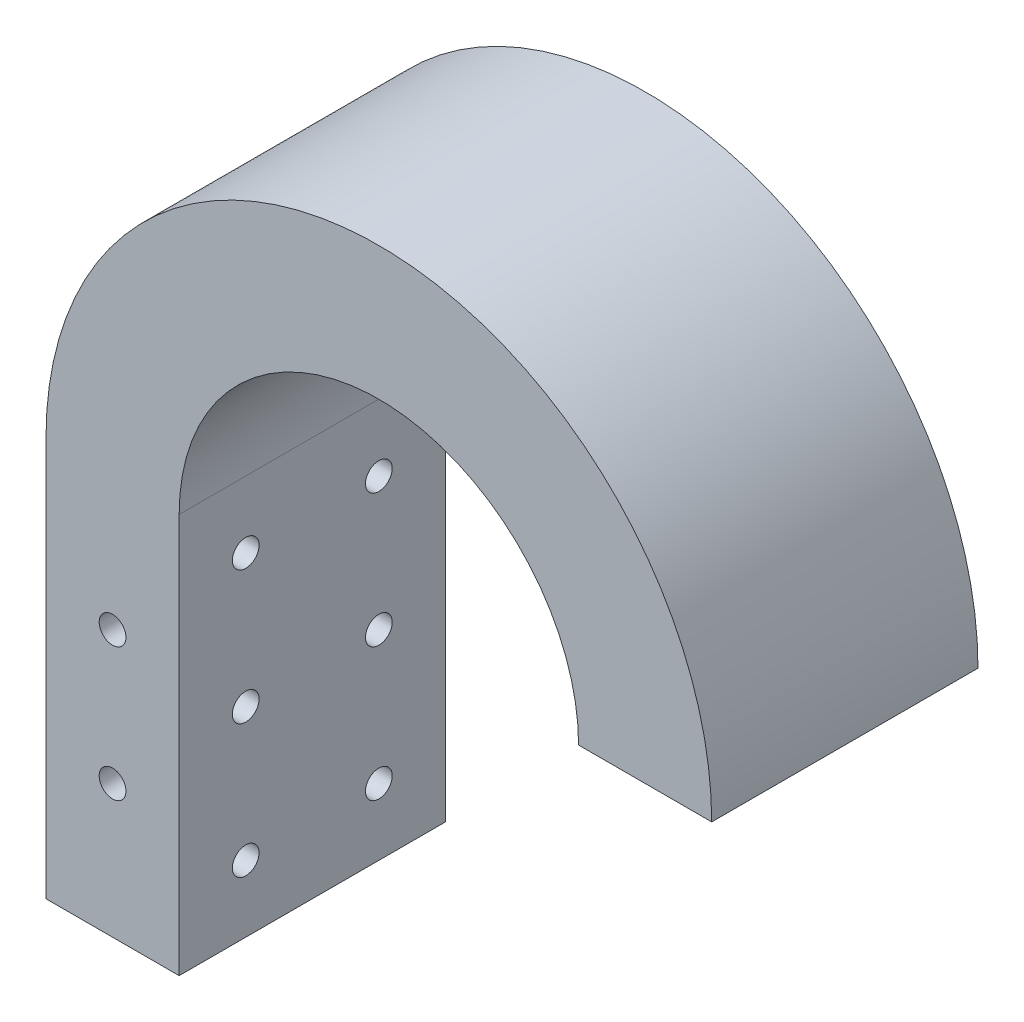
from build123d import *

# Parameters (mm, degrees)
BOSS_EXTRUDE1_DEPTH    = 50.8
F_10_CLEARANCE_HOLE1_D = 5.1054
F_10_CLEARANCE_HOLE2_D = 5.1054


with BuildPart() as part:
    # Sketch1 → Boss-Extrude1 (new body)
    with BuildSketch(Plane.XY):
        with BuildLine():
            Line((101.6, 76.2), (127, 76.2))
            ThreePointArc((127, 76.2), (63.5, 139.7), (0, 76.2))
            Line((0, 76.2), (0, 0))
            Line((0, 0), (25.4, 0))
            Line((25.4, 0), (25.4, 76.2))
            ThreePointArc((25.4, 76.2), (63.5, 114.3), (101.6, 76.2))
        make_face()
    extrude(amount=BOSS_EXTRUDE1_DEPTH)

    # #10 Clearance Hole1 (through all)
    with Locations(Plane.XY.offset(50.8)):
        with Locations((12.7, 50.8), (12.7, 25.4)):
            Hole(F_10_CLEARANCE_HOLE1_D / 2)

    # #10 Clearance Hole2 (through all)
    with Locations(Plane.ZY):
        with Locations((12.7, 38.1), (12.7, 12.7), (12.7, 63.5), (38.1, 63.5), (38.1, 12.7), (38.1, 38.1)):
            Hole(F_10_CLEARANCE_HOLE2_D / 2)


solid = part.part
